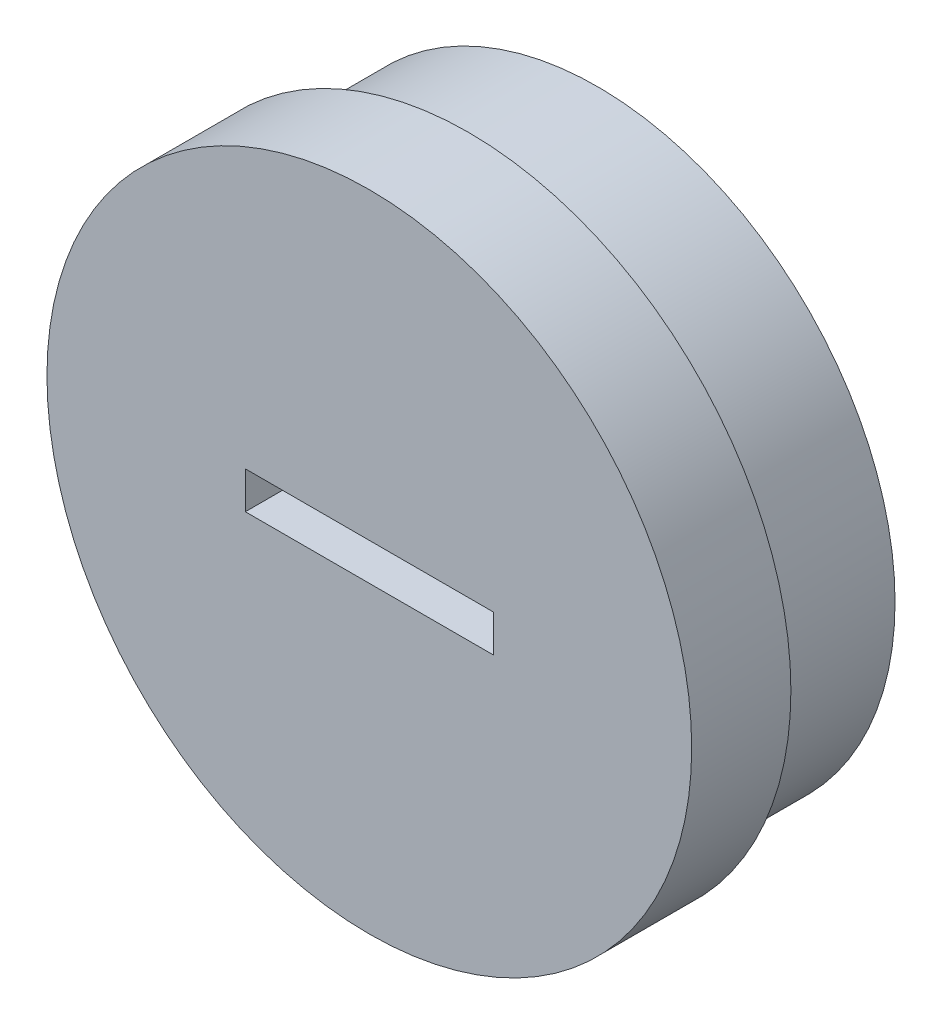
from build123d import *

# Parameters (mm, degrees)
SKETCH_1_R          = 13
EXTRUDE_1_DEPTH     = 4
SKETCH_2_R          = 12
SKETCH_2_R_2        = 10.075
EXTRUDE_2_DEPTH     = 5.2
SKETCH_3_W          = 10
SKETCH_3_H          = 1.5
CUT_EXTRUDE_1_DEPTH = 2.5


with BuildPart() as part:
    # 스케치1 → 보스-돌출1 (new body)
    with BuildSketch(Plane.XY):
        Circle(SKETCH_1_R)
    extrude(amount=EXTRUDE_1_DEPTH)

    # 스케치2 → 보스-돌출2 (add)
    with BuildSketch(Plane.XY):
        Circle(SKETCH_2_R)
        Circle(SKETCH_2_R_2, mode=Mode.SUBTRACT)
    extrude(amount=-EXTRUDE_2_DEPTH)

    # 스케치3 → 컷-돌출1 (cut)
    with BuildSketch(Plane.XY.offset(4)):
        Rectangle(SKETCH_3_W, SKETCH_3_H)
    extrude(amount=-CUT_EXTRUDE_1_DEPTH, mode=Mode.SUBTRACT)


solid = part.part
